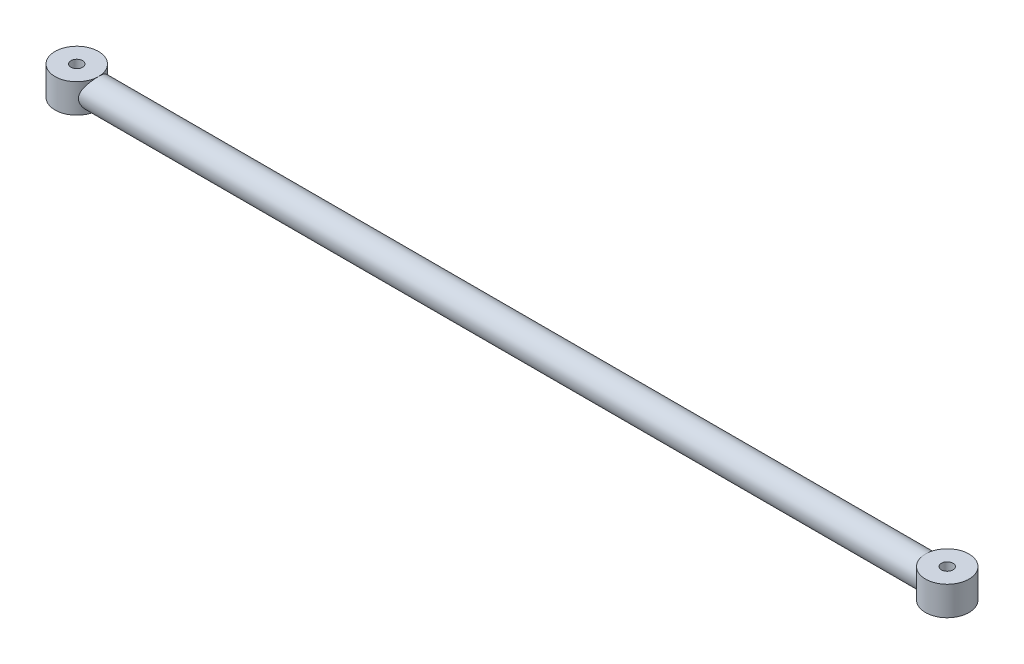
from build123d import *
from build123d.topology import SkipClean

# Parameters (mm, degrees)
SKETCH1_R                            = 7.5
SKETCH1_R_2                          = 2
BOSS_EXTRUDE1_DEPTH                  = 10
BOSS_EXTRUDE1_2_DEPTH                = 10
BOSS_EXTRUDE2_REACH                  = 159.995
BOSS_EXTRUDE2_END_RADIUS             = 7.5
SKETCH2_R                            = 5
BOSS_EXTRUDE2_DIRECTION_2_REACH      = 159.995
BOSS_EXTRUDE2_DIRECTION_2_END_RADIUS = 7.5


with BuildPart() as part:
    # Sketch1 → Boss-Extrude1 (new body)
    with BuildSketch(Plane(origin=(0, 0, 0), x_dir=(1, 0, 0), z_dir=(0, 1, 0))):
        with Locations(Location((0, 0, 0), (0, 0, 270))):
            Circle(SKETCH1_R)
        with Locations(Location((0, 0, 0), (0, 0, 270))):
            Circle(SKETCH1_R_2, mode=Mode.SUBTRACT)
    extrude(amount=BOSS_EXTRUDE1_DEPTH)



with BuildPart() as body_2:
    # Sketch1 → Boss-Extrude1 2 (new body)
    with BuildSketch(Plane(origin=(0, 0, 0), x_dir=(1, 0, 0), z_dir=(0, 1, 0))):
        with Locations(Location((300, 0, 0), (0, 0, 270))):
            Circle(SKETCH1_R)
        with Locations(Location((300, 0, 0), (0, 0, 270))):
            Circle(SKETCH1_R_2, mode=Mode.SUBTRACT)
    extrude(amount=BOSS_EXTRUDE1_2_DEPTH)


with BuildPart() as part_1:
    with SkipClean():  # the faces are left unmerged after this step: merging them gives an invalid solid
        add(part.part)

        add(body_2.part)  # Boss-Extrude2 merges body 2
        # Boss-Extrude2: up to this cylinder (the profile starts outside it)
        boss_extrude2_end = Plane(origin=(300, 5, 0), z_dir=(0, -1, 0)) * Cylinder(BOSS_EXTRUDE2_END_RADIUS, 335.99, mode=Mode.PRIVATE)
        # Sketch2 → Boss-Extrude2 (add, up to the surface)
        with BuildSketch(Plane(origin=(150, 0, 0), x_dir=(0, 0, -1), z_dir=(1, 0, 0)), mode=Mode.PRIVATE) as boss_extrude2_sk1:
            with Locations(Location((0, 5, 0), (0, 0, 90))):
                Circle(SKETCH2_R)
        boss_extrude2_tool1 = extrude(boss_extrude2_sk1.sketch, amount=BOSS_EXTRUDE2_REACH, mode=Mode.PRIVATE) - boss_extrude2_end
        add(boss_extrude2_tool1.solids().sort_by_distance((150, 5, 0))[0])

    # Boss-Extrude2 direction 2: up to this cylinder (the profile starts outside it)
    boss_extrude2_direction_2_end = Plane(origin=(0, 5, 0), z_dir=(0, -1, 0)) * Cylinder(BOSS_EXTRUDE2_DIRECTION_2_END_RADIUS, 335.99, mode=Mode.PRIVATE)
    # Sketch2 → Boss-Extrude2 direction 2 (add, up to the surface)
    with BuildSketch(Plane(origin=(150, 0, 0), x_dir=(0, 0, -1), z_dir=(1, 0, 0)), mode=Mode.PRIVATE) as boss_extrude2_direction_2_sk1:
        with Locations(Location((0, 5, 0), (0, 0, 90))):
            Circle(SKETCH2_R)
    boss_extrude2_direction_2_tool1 = extrude(boss_extrude2_direction_2_sk1.sketch, amount=-BOSS_EXTRUDE2_DIRECTION_2_REACH, mode=Mode.PRIVATE) - boss_extrude2_direction_2_end
    add(boss_extrude2_direction_2_tool1.solids().sort_by_distance((150, 5, 0))[0])


solid = part_1.part
